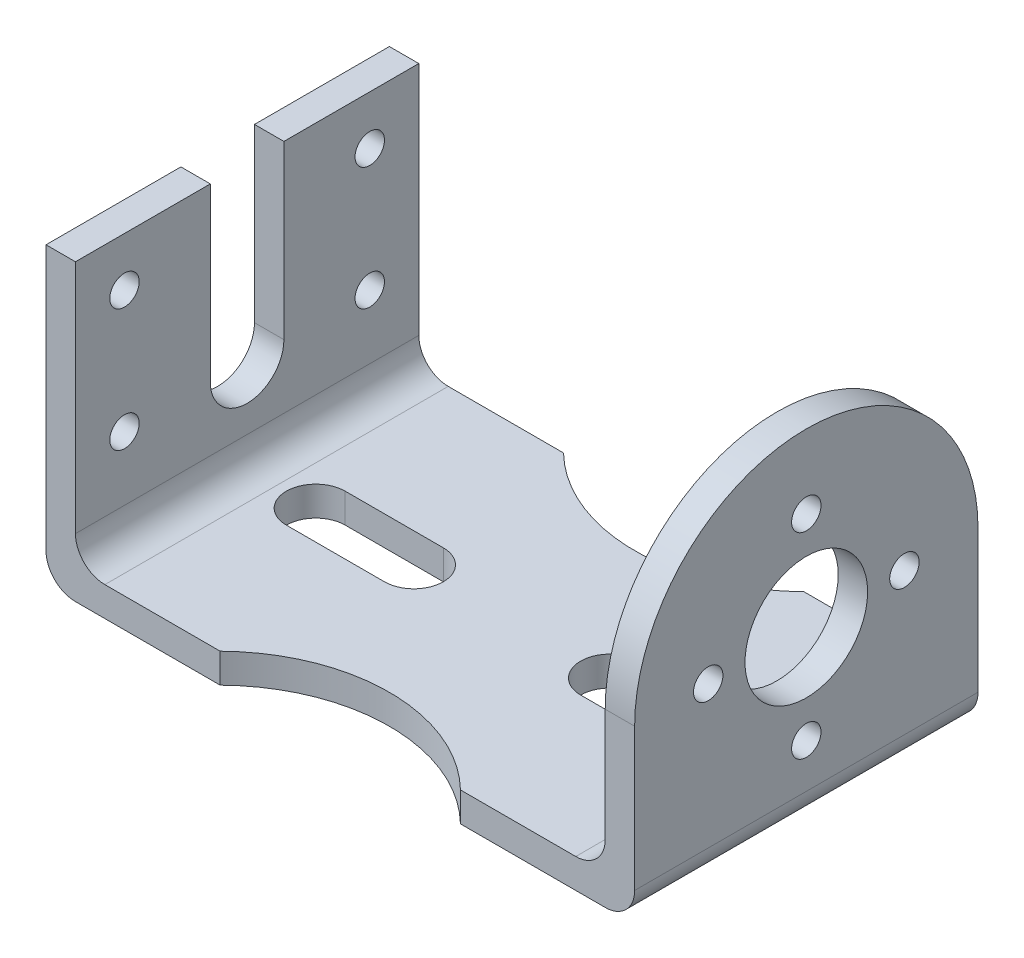
from build123d import *
from build123d.topology import SkipClean

# Parameters (mm, degrees)
BOSS_EXTRUDE1_DEPTH = 70
CUT_EXTRUDE1_DEPTH  = 33
BOSS_EXTRUDE2_DEPTH = 6
SKETCH4_R           = 12.5
CUT_EXTRUDE2_DEPTH  = 16
SKETCH5_R           = 3
CUT_EXTRUDE3_DEPTH  = 16
SKETCH6_R           = 3
CUT_EXTRUDE4_DEPTH  = 16
CUT_EXTRUDE5_DEPTH  = 16


with BuildPart() as part:
    # Sketch1 → Boss-Extrude1 (new body)
    with BuildSketch(Plane.XY):
        with BuildLine():
            Line((-54, 0), (54, 0))
            ThreePointArc((54, 0), (58.242640687, 1.757359313), (60, 6))
            Line((60, 6), (60, 60))
            Line((60, 60), (54, 60))
            Line((54, 60), (54, 12))
            ThreePointArc((54, 12), (52.242640687, 7.757359313), (48, 6))
            Line((48, 6), (-48, 6))
            ThreePointArc((-48, 6), (-52.242640687, 7.757359313), (-54, 12))
            Line((-54, 12), (-54, 60))
            Line((-54, 60), (-60, 60))
            Line((-60, 60), (-60, 6))
            ThreePointArc((-60, 6), (-58.242640687, 1.757359313), (-54, 0))
        make_face()
    extrude(amount=-BOSS_EXTRUDE1_DEPTH)

    # Sketch2 → Cut-Extrude1 (cut)
    with BuildSketch(Plane(origin=(60, 0, 0), x_dir=(0, 0, -1), z_dir=(1, 0, 0))):
        with BuildLine():
            Line((0, 35), (0, 60))
            Line((0, 60), (10.505102572, 60))
            ThreePointArc((10.505102572, 60), (2.732978058, 48.558735008), (0, 35))
        make_face()
        with BuildLine():
            Line((70, 35), (70, 60))
            Line((70, 60), (59.494897428, 60))
            ThreePointArc((59.494897428, 60), (67.267021942, 48.558735008), (70, 35))
        make_face()
    extrude(amount=-CUT_EXTRUDE1_DEPTH, mode=Mode.SUBTRACT)

    # Sketch3 → Boss-Extrude2 (add)
    with SkipClean():  # the faces are left unmerged after this step: merging them gives an invalid solid
        with BuildSketch(Plane(origin=(60, 0, 0), x_dir=(0, 0, -1), z_dir=(1, 0, 0))):
            with BuildLine():
                Line((10.505102572, 60), (59.494897428, 60))
                ThreePointArc((59.494897428, 60), (35, 70), (10.505102572, 60))
            make_face()
        extrude(amount=-BOSS_EXTRUDE2_DEPTH)

    # Sketch4 → Cut-Extrude2 (cut)
    with SkipClean():  # the faces are left unmerged after this step: merging them gives an invalid solid
        with BuildSketch(Plane(origin=(60, 0, 0), x_dir=(0, 0, -1), z_dir=(1, 0, 0))):
            with Locations((35, 35)):
                Circle(SKETCH4_R)
        extrude(amount=-CUT_EXTRUDE2_DEPTH, mode=Mode.SUBTRACT)

    # Sketch5 → Cut-Extrude3 (cut)
    with SkipClean():  # the faces are left unmerged after this step: merging them gives an invalid solid
        with BuildSketch(Plane(origin=(60, 0, 0), x_dir=(0, 0, -1), z_dir=(1, 0, 0))):
            with Locations((35, 55)):
                Circle(SKETCH5_R)
            with Locations((55, 35)):
                Circle(SKETCH5_R)
            with Locations((35, 15)):
                Circle(SKETCH5_R)
            with Locations((15, 35)):
                Circle(SKETCH5_R)
        extrude(amount=-CUT_EXTRUDE3_DEPTH, mode=Mode.SUBTRACT)

    # Sketch6 → Cut-Extrude4 (cut)
    with SkipClean():  # the faces are left unmerged after this step: merging them gives an invalid solid
        with BuildSketch(Plane.ZY.offset(60)):
            with Locations((-60, 50)):
                Circle(SKETCH6_R)
            with Locations((-60, 25)):
                Circle(SKETCH6_R)
            with Locations((-10, 50)):
                Circle(SKETCH6_R)
            with Locations((-10, 25)):
                Circle(SKETCH6_R)
            with BuildLine():
                Line((-42.5, 60), (-27.5, 60))
                Line((-27.5, 60), (-27.5, 25))
                ThreePointArc((-27.5, 25), (-35, 17.5), (-42.5, 25))
                Line((-42.5, 25), (-42.5, 60))
            make_face()
        extrude(amount=-CUT_EXTRUDE4_DEPTH, mode=Mode.SUBTRACT)

    # Sketch7 → Cut-Extrude5 (cut)
    with SkipClean():  # the faces are left unmerged after this step: merging them gives an invalid solid
        with BuildSketch(Plane(origin=(0, 6, 0), x_dir=(1, 0, 0), z_dir=(0, 1, 0))):
            with BuildLine():
                Line((-40, 41), (-20, 41))
                ThreePointArc((-20, 41), (-14, 35), (-20, 29))
                Line((-20, 29), (-40, 29))
                ThreePointArc((-40, 29), (-46, 35), (-40, 41))
            make_face()
            with BuildLine():
                Line((20, 29), (40, 29))
                ThreePointArc((40, 29), (46, 35), (40, 41))
                Line((40, 41), (20, 41))
                ThreePointArc((20, 41), (14, 35), (20, 29))
            make_face()
            with BuildLine():
                Line((-24.494897428, 0), (24.494897428, 0))
                ThreePointArc((24.494897428, 0), (0, 10), (-24.494897428, 0))
            make_face()
            with BuildLine():
                Line((-24.494897428, 70), (24.494897428, 70))
                ThreePointArc((24.494897428, 70), (0, 60), (-24.494897428, 70))
            make_face()
        extrude(amount=-CUT_EXTRUDE5_DEPTH, mode=Mode.SUBTRACT)


solid = part.part
